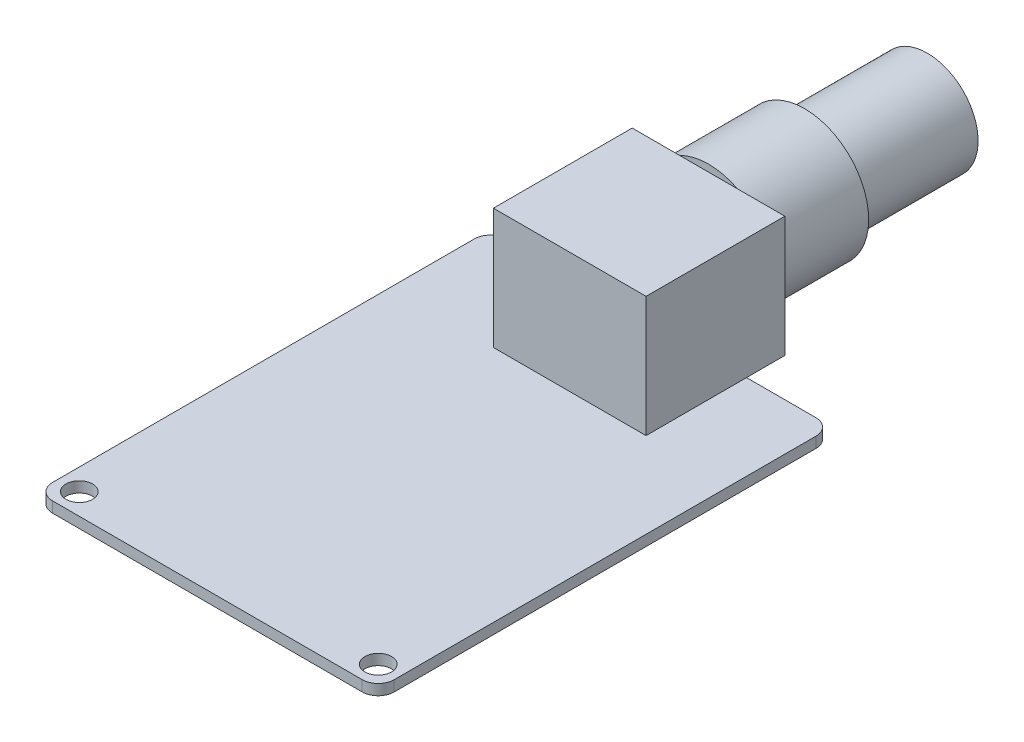
from build123d import *

# Parameters (mm, degrees)
EXTRUDE_1_DEPTH      = 3.5
EXTRUDE_1_DEPTH_BACK = 5.5
SKETCH_1_R           = 6
SKETCH_2_W           = 14.3
SKETCH_2_H           = 11.3
EXTRUDE_2_DEPTH      = 13
SKETCH_3_R           = 1.25
EXTRUDE_3_DEPTH      = 1
SKETCH_4_R           = 4.75
EXTRUDE_4_DEPTH      = 11.5
SKETCH_5_R           = 4.25
CUT_EXTRUDE_1_DEPTH  = 11.5


with BuildPart() as part:
    # 草圖1 → 填料-伸長1 (new, two sides: drawn at the far end of the back side and taken through both)
    with BuildSketch(Plane.XY.offset(-EXTRUDE_1_DEPTH_BACK)):
        with Locations((-64.340909091, 31.5)):
            Circle(SKETCH_1_R)
    extrude(amount=EXTRUDE_1_DEPTH + EXTRUDE_1_DEPTH_BACK)

    # 草圖2 → 填料-伸長2 (add)
    with BuildSketch(Plane.XY.offset(3.5)):
        with Locations((-64.340909091, 31.2)):
            Rectangle(SKETCH_2_W, SKETCH_2_H)
    extrude(amount=EXTRUDE_2_DEPTH)

    # 草圖3 → 填料-伸長3 (add)
    with BuildSketch(Plane.XZ.offset(-25.55)):
        with BuildLine():
            Line((-50.690909091, 7.087920564), (-79.690909091, 7.087920564))
            ThreePointArc((-79.690909091, 7.087920564), (-80.751569263, 7.527260393), (-81.190909091, 8.587920564))
            Line((-81.190909091, 8.587920564), (-81.190909091, 48.087920564))
            ThreePointArc((-81.190909091, 48.087920564), (-80.751569263, 49.148580736), (-79.690909091, 49.587920564))
            Line((-79.690909091, 49.587920564), (-50.690909091, 49.587920564))
            ThreePointArc((-50.690909091, 49.587920564), (-49.630248919, 49.148580736), (-49.190909091, 48.087920564))
            Line((-49.190909091, 48.087920564), (-49.190909091, 8.587920564))
            ThreePointArc((-49.190909091, 8.587920564), (-49.630248919, 7.527260393), (-50.690909091, 7.087920564))
        make_face()
        with Locations(Location((-51.190909091, 47.587920564, 0), (0, 0, 270))):
            Circle(SKETCH_3_R, mode=Mode.SUBTRACT)
        with Locations(Location((-79.190909091, 47.587920564, 0), (0, 0, 270))):
            Circle(SKETCH_3_R, mode=Mode.SUBTRACT)
    extrude(amount=EXTRUDE_3_DEPTH)

    # 草圖4 → 填料-伸長4 (add)
    with BuildSketch(Plane(origin=(0, 0, -5.5), x_dir=(-1, 0, 0), z_dir=(0, 0, -1))):
        with Locations((64.340909091, 31.5)):
            Circle(SKETCH_4_R)
    extrude(amount=EXTRUDE_4_DEPTH)

    # 草圖5 → 除料-伸長1 (cut)
    with BuildSketch(Plane(origin=(0, 0, -17), x_dir=(-1, 0, 0), z_dir=(0, 0, -1))):
        with Locations((64.340909091, 31.5)):
            Circle(SKETCH_5_R)
    extrude(amount=-CUT_EXTRUDE_1_DEPTH, mode=Mode.SUBTRACT)


solid = part.part
